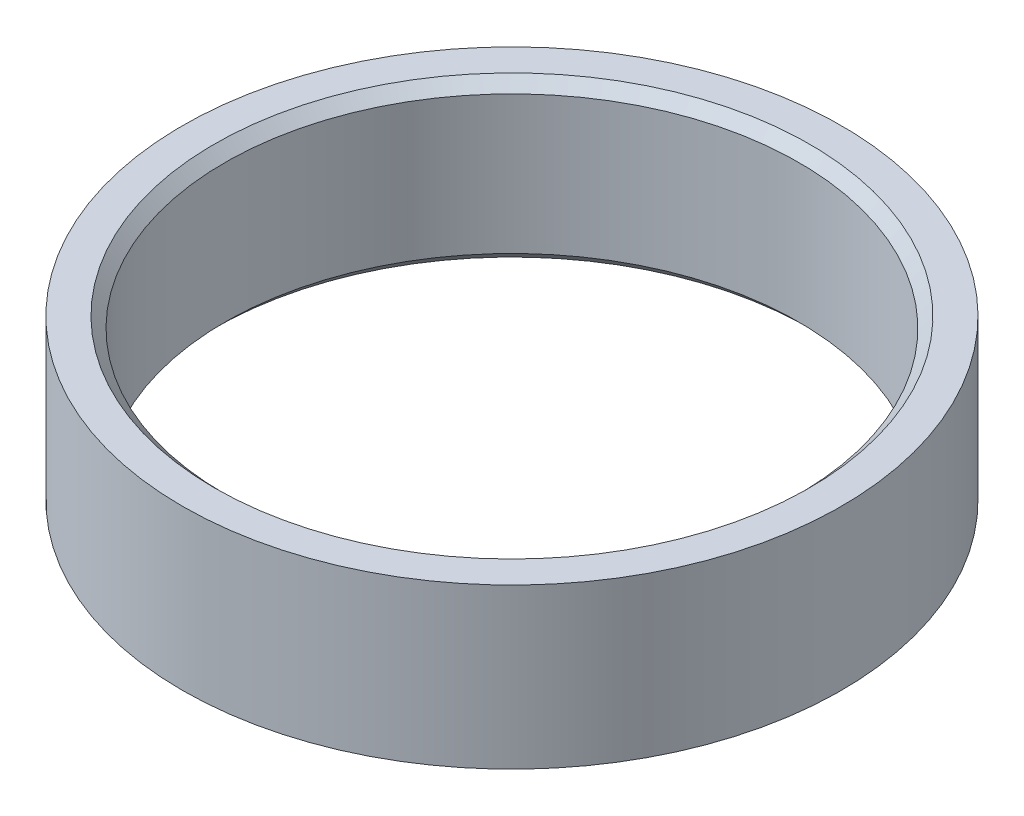
from build123d import *

# Parameters (mm, degrees)
SKETCH_1_R      = 15.5
SKETCH_1_R_2    = 13.5
EXTRUDE_1_DEPTH = 7.5
CHAMFER_1_SIZE  = 0.5


with BuildPart() as part:
    # 草图1 → 凸台-拉伸1 (new body)
    with BuildSketch(Plane(origin=(0, 0, 0), x_dir=(1, 0, 0), z_dir=(0, 1, 0))):
        with Locations(Location((0, 0, 0), (0, 0, 270))):
            Circle(SKETCH_1_R)
        with Locations(Location((0, 0, 0), (0, 0, 270))):
            Circle(SKETCH_1_R_2, mode=Mode.SUBTRACT)
    extrude(amount=EXTRUDE_1_DEPTH)

    # 倒角1
    chamfer_1_edges = [part.edges().sort_by_distance(p)[0] for p in [
        (0, 0, -13.5),
        (0, 7.5, -13.5),
    ]]
    chamfer(chamfer_1_edges, length=CHAMFER_1_SIZE)


solid = part.part
